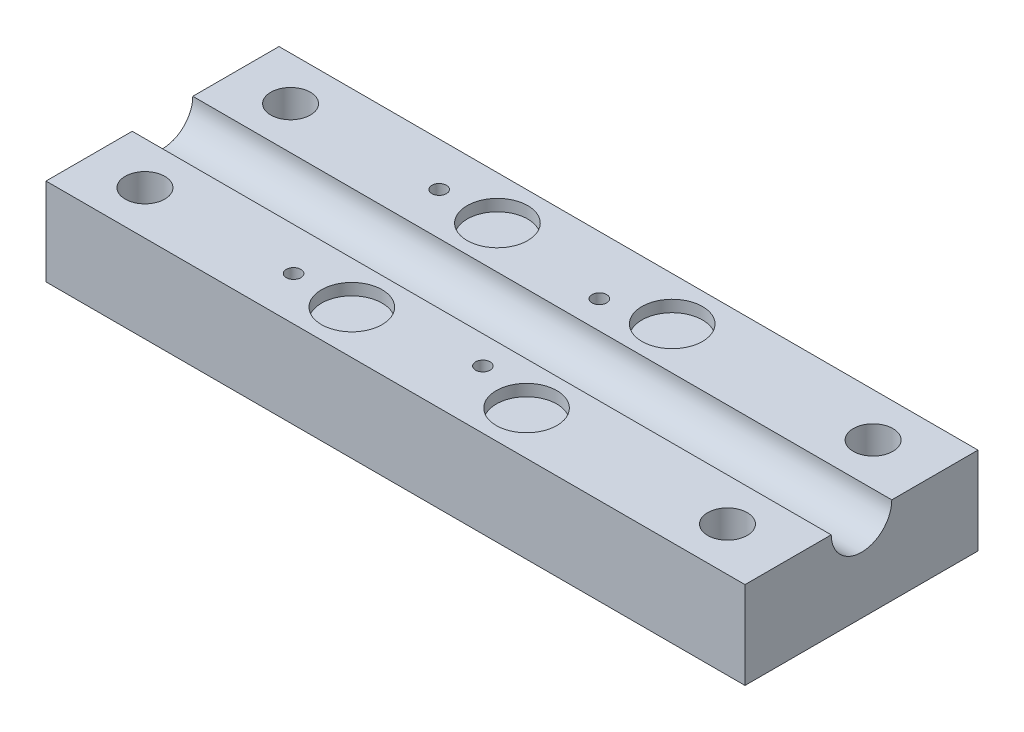
from build123d import *

# Parameters (mm, degrees)
SKETCH1_W           = 76.2
SKETCH1_H           = 25.4
BOSS_EXTRUDE1_DEPTH = 9.525
SKETCH2_R           = 2.159
CUT_EXTRUDE1_DEPTH  = 42.275
SKETCH3_R           = 3.302
CUT_EXTRUDE2_DEPTH  = 1.27
SKETCH4_R           = 0.79375
CUT_EXTRUDE3_DEPTH  = 42.275
SKETCH5_R           = 3.302
CUT_EXTRUDE4_DEPTH  = 78.836081768


with BuildPart() as part:
    # Sketch1 → Boss-Extrude1 (new body)
    with BuildSketch(Plane(origin=(0, 0, 0), x_dir=(1, 0, 0), z_dir=(0, 1, 0))):
        Rectangle(SKETCH1_W, SKETCH1_H)
    extrude(amount=BOSS_EXTRUDE1_DEPTH)

    # Sketch2 → Cut-Extrude1 (cut, through all)
    with BuildSketch(Plane(origin=(0, 9.525, 0), x_dir=(1, 0, 0), z_dir=(0, 1, 0))):
        with Locations(Location((-32.074075882, 7.9375, 0), (0, 0, 270))):
            Circle(SKETCH2_R)
        with Locations(Location((-32.074075882, -7.9375, 0), (0, 0, 270))):
            Circle(SKETCH2_R)
        with Locations(Location((31.425924118, 7.9375, 0), (0, 0, 270))):
            Circle(SKETCH2_R)
        with Locations(Location((31.425924118, -7.9375, 0), (0, 0, 270))):
            Circle(SKETCH2_R)
    extrude(amount=-CUT_EXTRUDE1_DEPTH, mode=Mode.SUBTRACT)

    # Sketch3 → Cut-Extrude2 (cut)
    with BuildSketch(Plane(origin=(0, 9.525, 0), x_dir=(1, 0, 0), z_dir=(0, 1, 0))):
        with Locations(Location((-9.525, 7.9375, 0), (0, 0, 270))):
            Circle(SKETCH3_R)
        with Locations(Location((-9.525, -7.9375, 0), (0, 0, 270))):
            Circle(SKETCH3_R)
        with Locations(Location((9.525, -7.9375, 0), (0, 0, 270))):
            Circle(SKETCH3_R)
        with Locations(Location((9.525, 7.9375, 0), (0, 0, 270))):
            Circle(SKETCH3_R)
    extrude(amount=-CUT_EXTRUDE2_DEPTH, mode=Mode.SUBTRACT)

    # Sketch4 → Cut-Extrude3 (cut, through all)
    with BuildSketch(Plane(origin=(0, 9.525, 0), x_dir=(1, 0, 0), z_dir=(0, 1, 0))):
        with Locations(Location((-15.875, 7.9375, 0), (0, 0, 270))):
            Circle(SKETCH4_R)
        with Locations(Location((-15.875, -7.9375, 0), (0, 0, 270))):
            Circle(SKETCH4_R)
        with Locations(Location((3.175, 6.35, 0), (0, 0, 270))):
            Circle(SKETCH4_R)
        with Locations(Location((3.175, -6.35, 0), (0, 0, 270))):
            Circle(SKETCH4_R)
    extrude(amount=-CUT_EXTRUDE3_DEPTH, mode=Mode.SUBTRACT)

    # Sketch5 → Cut-Extrude4 (cut, through all)
    with BuildSketch(Plane.ZY.offset(38.1)):
        with Locations((0, 9.525)):
            Circle(SKETCH5_R)
    extrude(amount=-CUT_EXTRUDE4_DEPTH, mode=Mode.SUBTRACT)


solid = part.part
